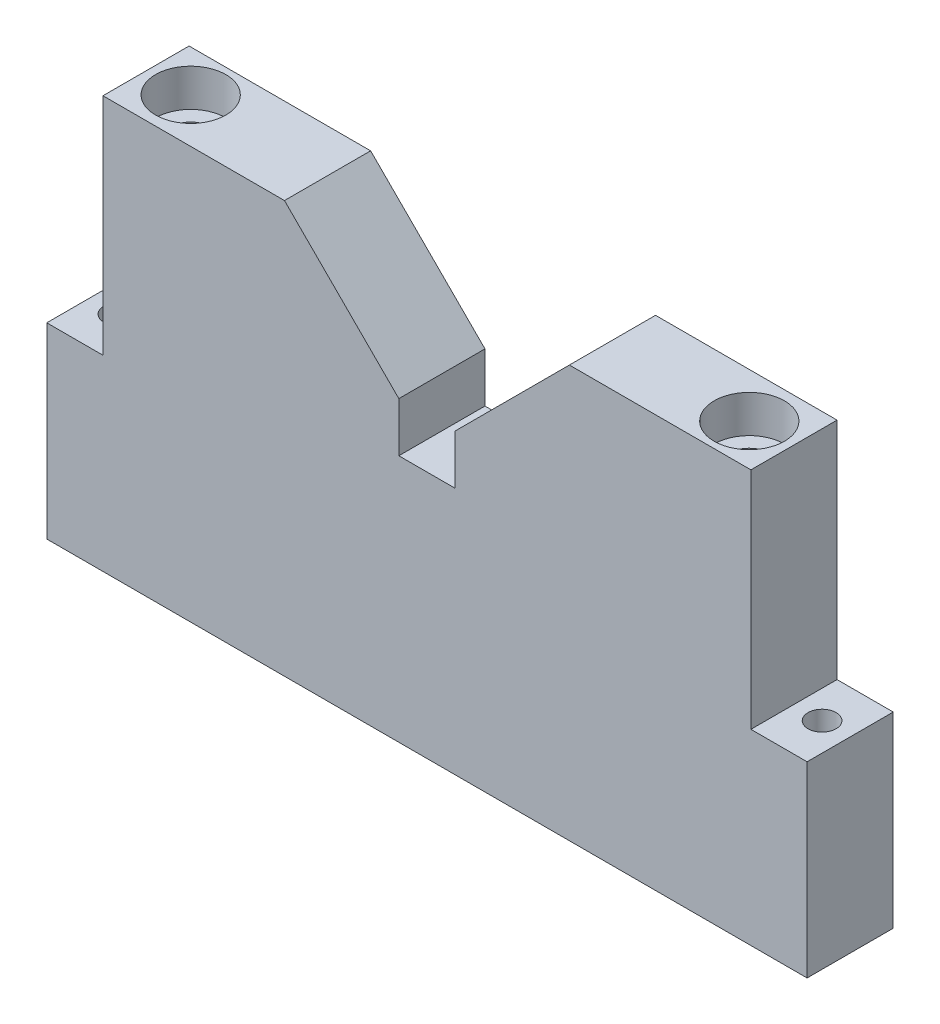
from build123d import *

# Parameters (mm, degrees)
EXTRUDE_1_DEPTH             = 9.2
SKETCH_2_W                  = 162.4
SKETCH_2_H                  = 18.4
EXTRUDE_2_DEPTH             = 40
HOLE_WIZARD_M82_D           = 8.4
HOLE_WIZARD_M82_CBORE_D     = 15
HOLE_WIZARD_M82_CBORE_DEPTH = 8
HOLE_WIZARD_6_0_6_2_D       = 6


with BuildPart() as part:
    # Эскиз1 → Бобышка-Вытянуть1 (new, symmetric)
    with BuildSketch(Plane.XY):
        Polygon((-69.2, -12), (-30.426406871, -12), (-6, -36.426406871), (-6, -47), (6, -47), (6, -36.426406871), (30.426406871, -12), (69.2, -12), (69.2, -60), (-69.2, -60), align=None)
    extrude(amount=EXTRUDE_1_DEPTH, both=True)

    # Эскиз2 → Бобышка-Вытянуть2 (add)
    with BuildSketch(Plane.XZ.offset(60)):
        Rectangle(SKETCH_2_W, SKETCH_2_H)
    extrude(amount=EXTRUDE_2_DEPTH)

    # Цековка для винта с внутренним шестигранником M82 (through all)
    with Locations(Plane(origin=(0, -12, 0), x_dir=(-1, 0, 0), z_dir=(0, 1, 0))):
        with Locations((-60, 0.343824936), (60, -0.343824936)):
            CounterBoreHole(HOLE_WIZARD_M82_D / 2, HOLE_WIZARD_M82_CBORE_D / 2, HOLE_WIZARD_M82_CBORE_DEPTH)

    # Диаметр отверстия Ø6.0 (6)2 (through all)
    with Locations(Plane(origin=(0, -60, 0), x_dir=(-1, 0, 0), z_dir=(0, 1, 0))):
        with Locations((-75.2, 0), (75.2, 0)):
            Hole(HOLE_WIZARD_6_0_6_2_D / 2)


solid = part.part
